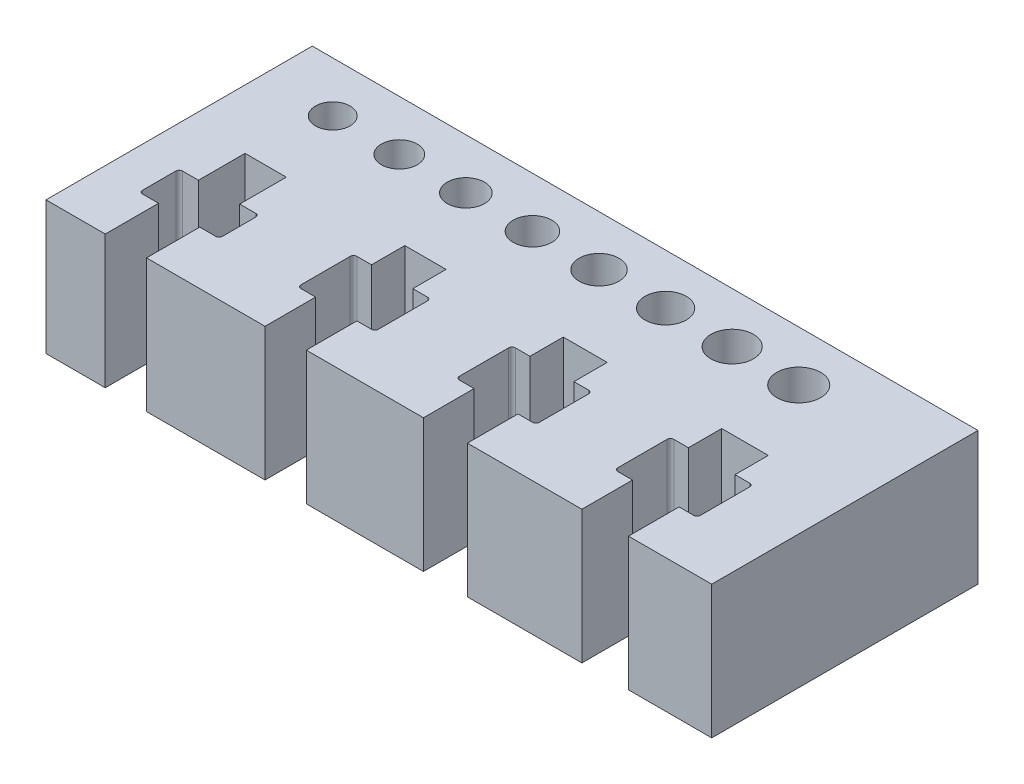
from build123d import *

# Parameters (mm, degrees)
SKETCH2_W           = 50
SKETCH2_H           = 20
BOSS_EXTRUDE1_DEPTH = 10
SKETCH3_R           = 1.3
SKETCH3_R_2         = 1.35
SKETCH3_R_3         = 1.4
SKETCH3_R_4         = 1.45
SKETCH3_R_5         = 1.5
SKETCH3_R_6         = 1.55
SKETCH3_R_7         = 1.6
SKETCH3_R_8         = 1.65
CUT_EXTRUDE1_DEPTH  = 29.722813233


with BuildPart() as part:
    # Sketch2 → Boss-Extrude1 (new body)
    with BuildSketch(Plane(origin=(0, 0, 0), x_dir=(1, 0, 0), z_dir=(0, 1, 0))):
        Rectangle(SKETCH2_W, SKETCH2_H)
    extrude(amount=BOSS_EXTRUDE1_DEPTH)

    # Sketch3 → Cut-Extrude1 (cut, through all)
    with BuildSketch(Plane(origin=(0, 10, 0), x_dir=(1, 0, 0), z_dir=(0, 1, 0))):
        with Locations(Location((-19.685722489, 6.222302146, 0), (0, 0, 270))):
            Circle(SKETCH3_R)
        with Locations(Location((-14.685722489, 6.222302146, 0), (0, 0, 270))):
            Circle(SKETCH3_R_2)
        with Locations(Location((-9.685722489, 6.222302146, 0), (0, 0, 270))):
            Circle(SKETCH3_R_3)
        with Locations(Location((-4.685722489, 6.222302146, 0), (0, 0, 270))):
            Circle(SKETCH3_R_4)
        with Locations(Location((0.314277511, 6.222302146, 0), (0, 0, 270))):
            Circle(SKETCH3_R_5)
        with Locations(Location((5.314277511, 6.222302146, 0), (0, 0, 270))):
            Circle(SKETCH3_R_6)
        with Locations(Location((10.314277511, 6.222302146, 0), (0, 0, 270))):
            Circle(SKETCH3_R_7)
        with Locations(Location((15.314277511, 6.222302146, 0), (0, 0, 270))):
            Circle(SKETCH3_R_8)
        with BuildLine():
            Line((6.65, -10), (3.35, -10))
            Line((3.35, -10), (3.35, -6.2))
            Line((3.35, -6.2), (2.25, -6.2))
            ThreePointArc((2.25, -6.2), (2.073223305, -6.126776695), (2, -5.95))
            Line((2, -5.95), (2, -2.25))
            ThreePointArc((2, -2.25), (2.073223305, -2.073223305), (2.25, -2))
            Line((2.25, -2), (3.35, -2))
            Line((3.35, -2), (3.35, 0.5))
            Line((3.35, 0.5), (6.65, 0.5))
            Line((6.65, 0.5), (6.65, -2))
            Line((6.65, -2), (7.75, -2))
            ThreePointArc((7.75, -2), (7.926776695, -2.073223305), (8, -2.25))
            Line((8, -2.25), (8, -5.95))
            ThreePointArc((8, -5.95), (7.926776695, -6.126776695), (7.75, -6.2))
            Line((7.75, -6.2), (6.65, -6.2))
            Line((6.65, -6.2), (6.65, -10))
        make_face()
        with BuildLine():
            Line((15.25, 0.5), (18.75, 0.5))
            Line((18.75, 0.5), (18.75, -2))
            Line((18.75, -2), (19.85, -2))
            ThreePointArc((19.85, -2), (20.026776695, -2.073223305), (20.1, -2.25))
            Line((20.1, -2.25), (20.1, -5.95))
            ThreePointArc((20.1, -5.95), (20.026776695, -6.126776695), (19.85, -6.2))
            Line((19.85, -6.2), (18.75, -6.2))
            Line((18.75, -6.2), (18.75, -10))
            Line((18.75, -10), (15.25, -10))
            Line((15.25, -10), (15.25, -6.2))
            Line((15.25, -6.2), (14.15, -6.2))
            ThreePointArc((14.15, -6.2), (13.973223305, -6.126776695), (13.9, -5.95))
            Line((13.9, -5.95), (13.9, -2.25))
            ThreePointArc((13.9, -2.25), (13.973223305, -2.073223305), (14.15, -2))
            Line((14.15, -2), (15.25, -2))
            Line((15.25, -2), (15.25, 0.5))
        make_face()
        with BuildLine():
            Line((-8.55, 0.5), (-5.45, 0.5))
            Line((-5.45, 0.5), (-5.45, -2))
            Line((-5.45, -2), (-4.35, -2))
            ThreePointArc((-4.35, -2), (-4.173223305, -2.073223305), (-4.1, -2.25))
            Line((-4.1, -2.25), (-4.1, -5.95))
            ThreePointArc((-4.1, -5.95), (-4.173223305, -6.126776695), (-4.35, -6.2))
            Line((-4.35, -6.2), (-5.45, -6.2))
            Line((-5.45, -6.2), (-5.45, -10))
            Line((-5.45, -10), (-8.55, -10))
            Line((-8.55, -10), (-8.55, -6.2))
            Line((-8.55, -6.2), (-9.65, -6.2))
            ThreePointArc((-9.65, -6.2), (-9.826776695, -6.126776695), (-9.9, -5.95))
            Line((-9.9, -5.95), (-9.9, -2.25))
            ThreePointArc((-9.9, -2.25), (-9.826776695, -2.073223305), (-9.65, -2))
            Line((-9.65, -2), (-8.55, -2))
            Line((-8.55, -2), (-8.55, 0.5))
        make_face()
        with BuildLine():
            Line((-20.55, 0.5), (-17.45, 0.5))
            Line((-17.45, 0.5), (-17.45, -3))
            Line((-17.45, -3), (-16.25, -3))
            ThreePointArc((-16.25, -3), (-16.073223305, -3.073223305), (-16, -3.25))
            Line((-16, -3.25), (-16, -5.75))
            ThreePointArc((-16, -5.75), (-16.073223305, -5.926776695), (-16.25, -6))
            Line((-16.25, -6), (-17.45, -6))
            Line((-17.45, -6), (-17.45, -10))
            Line((-17.45, -10), (-20.55, -10))
            Line((-20.55, -10), (-20.55, -6))
            Line((-20.55, -6), (-21.75, -6))
            ThreePointArc((-21.75, -6), (-21.926776695, -5.926776695), (-22, -5.75))
            Line((-22, -5.75), (-22, -3.25))
            ThreePointArc((-22, -3.25), (-21.926776695, -3.073223305), (-21.75, -3))
            Line((-21.75, -3), (-20.55, -3))
            Line((-20.55, -3), (-20.55, 0.5))
        make_face()
    extrude(amount=-CUT_EXTRUDE1_DEPTH, mode=Mode.SUBTRACT)


solid = part.part
